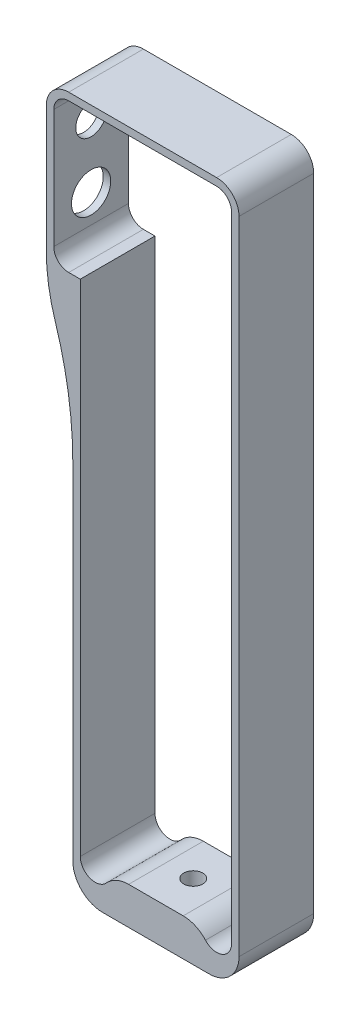
from build123d import *

# Parameters (mm, degrees)
SKETCH_1_W                = 44.5
SKETCH_1_H                = 182
EXTRUDE_1_DEPTH           = 20
FILLET_1_R                = 8
HOLE_WIZARD_1_4_201_D     = 5.1054
HOLE_WIZARD_1_4_201_DEPTH = 10
EXTRUDE_2_DEPTH           = 20
FILLET_2_R                = 100
CUT_EXTRUDE_1_REACH       = 180.298
CUT_EXTRUDE_2_REACH       = 180.781
SKETCH_7_R                = 5.25
EXTRUDE_3_DEPTH           = 20
FILLET_7_R                = 4
SKETCH_10_W               = 2
SKETCH_10_H               = 17.136672327
EXTRUDE_4_DEPTH           = 20
CUT_EXTRUDE_3_REACH       = 182.814
SKETCH_11_R               = 4.1
CUT_EXTRUDE_START         = -20
SKETCH_12_W               = 51.6
SKETCH_12_H               = 2.481518881
CUT_EXTRUDE_4_DEPTH       = 20
EXTRUDE_5_DEPTH           = 20


with BuildPart() as part:
    # Эскиз1 → Бобышка-Вытянуть1 (new body)
    with BuildSketch(Plane.XY):
        with Locations((20.25, 81)):
            Rectangle(SKETCH_1_W, SKETCH_1_H)
        with BuildLine():
            Line((8, 0), (32.5, 0))
            ThreePointArc((32.5, 0), (36.5, -4), (40.5, 0))
            Line((40.5, 0), (40.5, 170))
            Line((40.5, 170), (0, 170))
            Line((0, 170), (0, 0))
            ThreePointArc((0, 0), (4, -4), (8, 0))
        make_face(mode=Mode.SUBTRACT)
    extrude(amount=EXTRUDE_1_DEPTH)

    # Скругление1
    fillet_1_edges = [part.edges().sort_by_distance(p)[0] for p in [
        (8, 0, 10),
        (32.5, 0, 10),
        (42.5, -10, 10),
        (-2, -10, 10),
    ]]
    fillet(fillet_1_edges, radius=FILLET_1_R)

    # Отверстие обработанное метчиком 1/4-201
    with Locations(Plane(origin=(0, -10, 0), x_dir=(-1, 0, 0), z_dir=(0, -1, 0))):
        with Locations((-20.25, -10)):
            Hole(HOLE_WIZARD_1_4_201_D / 2, depth=HOLE_WIZARD_1_4_201_DEPTH)

    # Эскиз5 → Бобышка-Вытянуть2 (add)
    with BuildSketch(Plane.XY.offset(20)):
        with BuildLine():
            Line((-7.1, 155), (-7.1, 136))
            ThreePointArc((-7.1, 136), (-5.807601094, 124.936546651), (-2, 114.468859761))
            Line((-2, 114.468859761), (-2, 110.317515696))
            ThreePointArc((-2, 110.317515696), (-7.29232304, 122.677087406), (-9.1, 136))
            Line((-9.1, 136), (-9.1, 155))
            Line((-9.1, 155), (-7.1, 155))
        make_face()
    extrude(amount=-EXTRUDE_2_DEPTH)

    # Скругление2
    fillet_2_edges = [part.edges().sort_by_distance(p)[0] for p in [
        (-2, 110.317515696, 10),
    ]]
    fillet(fillet_2_edges, radius=FILLET_2_R)

    # Эскиз6 → Вырез-Вытянуть1 (cut, up to next)
    with BuildSketch(Plane.XY.offset(20), mode=Mode.PRIVATE) as cut_extrude_1_sk1:
        Polygon((0, 170), (0, 114.468859761), (-2, 114.468859761), (-2, 170), (-2, 172), (42.5, 172), (42.5, 170), align=None)
    cut_extrude_1_tool1 = extrude(cut_extrude_1_sk1.sketch, amount=-CUT_EXTRUDE_1_REACH, mode=Mode.PRIVATE) & part.part
    add(cut_extrude_1_tool1.solids().sort_by_distance((-0.72733, 142.23443, 20))[0], mode=Mode.SUBTRACT)

    # Эскиз7 → Вырез-Вытянуть2 (cut, up to next)
    with BuildSketch(Plane.ZY.offset(9.1), mode=Mode.PRIVATE) as cut_extrude_2_sk1:
        with Locations((10, 145.426275666)):
            Circle(SKETCH_7_R)
    cut_extrude_2_tool1 = extrude(cut_extrude_2_sk1.sketch, amount=-CUT_EXTRUDE_2_REACH, mode=Mode.PRIVATE) & part.part
    add(cut_extrude_2_tool1.solids().sort_by_distance((-9.1, 145.426276, 10))[0], mode=Mode.SUBTRACT)

    # Эскиз9 → Бобышка-Вытянуть3 (add)
    with BuildSketch(Plane.XY.offset(20)):
        with BuildLine():
            Line((-7.051971502, 133.853274797), (0, 133.853274797))
            Line((0, 133.853274797), (0, 114.468859761))
            Line((0, 114.468859761), (-2, 114.468859761))
            ThreePointArc((-2, 114.468859761), (-5.548456035, 123.894590796), (-7.051971502, 133.853274797))
        make_face()
    extrude(amount=-EXTRUDE_3_DEPTH)

    # Скругление7
    fillet_7_edges = [part.edges().sort_by_distance(p)[0] for p in [
        (-7.051971502, 133.853274797, 10),
    ]]
    fillet(fillet_7_edges, radius=FILLET_7_R)

    # Эскиз10 → Бобышка-Вытянуть4 (add)
    with BuildSketch(Plane.XY.offset(20)):
        with Locations((-8.1, 163.568336164)):
            Rectangle(SKETCH_10_W, SKETCH_10_H)
    extrude(amount=-EXTRUDE_4_DEPTH)

    # Эскиз11 → Вырез-Вытянуть3 (cut, up to next)
    with BuildSketch(Plane.ZY.offset(9.1), mode=Mode.PRIVATE) as cut_extrude_3_sk1:
        with Locations((10, 162.426275666)):
            Circle(SKETCH_11_R)
    cut_extrude_3_tool1 = extrude(cut_extrude_3_sk1.sketch, amount=-CUT_EXTRUDE_3_REACH, mode=Mode.PRIVATE) & part.part
    add(cut_extrude_3_tool1.solids().sort_by_distance((-9.1, 162.426276, 10))[0], mode=Mode.SUBTRACT)

    # Эскиз12 → Вырез-Вытянуть4 (cut)
    with BuildSketch(Plane.XY.offset(20).offset(CUT_EXTRUDE_START)):
        with Locations((16.7, 170.895912887)):
            Rectangle(SKETCH_12_W, SKETCH_12_H)
    extrude(amount=CUT_EXTRUDE_4_DEPTH, mode=Mode.SUBTRACT)

    # Эскиз13 → Бобышка-Вытянуть5 (add)
    with BuildSketch(Plane.XY.offset(20)):
        with BuildLine():
            Line((36.5, 175.655153446), (-3.1, 175.655153446))
            ThreePointArc((-3.1, 175.655153446), (-7.342640687, 173.897794133), (-9.1, 169.655153446))
            Line((-9.1, 169.655153446), (-7.1, 169.655153446))
            ThreePointArc((-7.1, 169.655153446), (-5.928427125, 172.483580571), (-3.1, 173.655153446))
            Line((-3.1, 173.655153446), (36.5, 173.655153446))
            ThreePointArc((36.5, 173.655153446), (39.328427125, 172.483580571), (40.5, 169.655153446))
            Line((40.5, 169.655153446), (42.5, 169.655153446))
            ThreePointArc((42.5, 169.655153446), (40.742640687, 173.897794133), (36.5, 175.655153446))
        make_face()
    extrude(amount=-EXTRUDE_5_DEPTH)


solid = part.part
